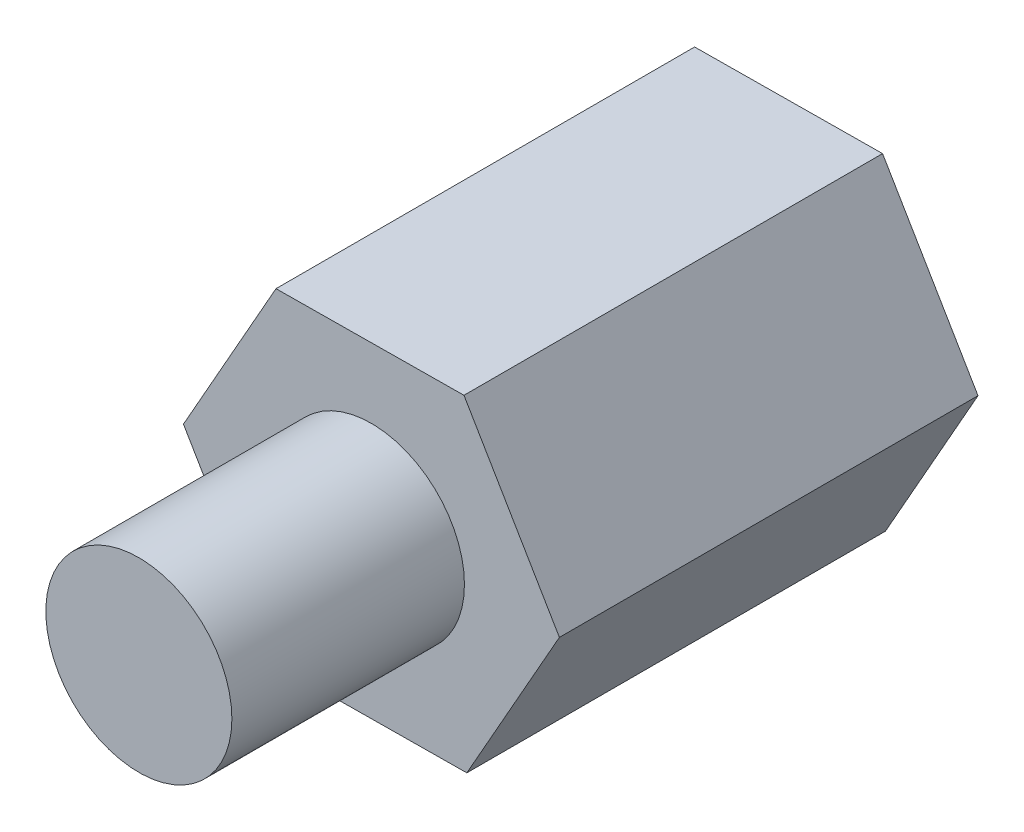
from build123d import *

# Parameters (mm, degrees)
SKETCH_1_R      = 2
EXTRUDE_1_DEPTH = 9
SKETCH_3_R      = 2
EXTRUDE_2_DEPTH = 5


with BuildPart() as part:
    # 草图1 → 凸台-拉伸1 (new body)
    with BuildSketch(Plane.XY):
        Polygon((2.051456248, -3.482077052), (4.041295309, 0.035574699), (1.989839061, 3.517651751), (-2.051456248, 3.482077052), (-4.041295309, -0.035574699), (-1.989839061, -3.517651751), align=None)
        Circle(SKETCH_1_R, mode=Mode.SUBTRACT)
    extrude(amount=EXTRUDE_1_DEPTH)


with BuildPart() as body_2:
    # 草图3 → 凸台-拉伸2 (new body)
    with BuildSketch(Plane.XY.offset(9)):
        Circle(SKETCH_3_R)
    extrude(amount=EXTRUDE_2_DEPTH)


solid = Compound([part.part, body_2.part])
